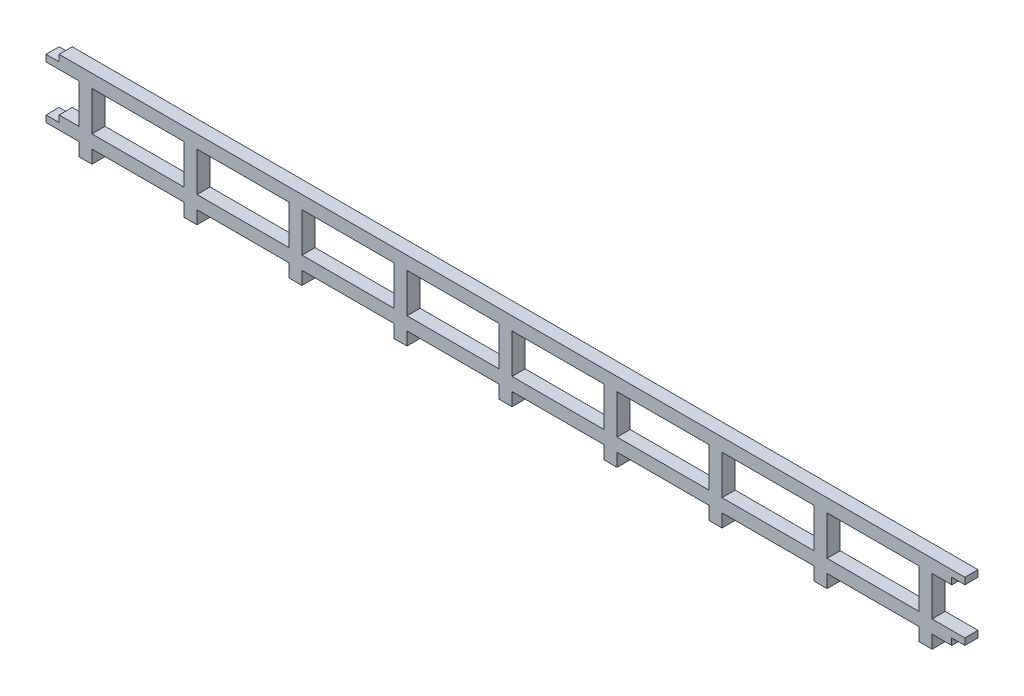
from build123d import *

# Parameters (mm, degrees)
SKETCH1_W           = 21
SKETCH1_H           = 9
BOSS_EXTRUDE1_DEPTH = 3


with BuildPart() as part:
    # Sketch1 → Boss-Extrude1 (new body)
    with BuildSketch(Plane.XY):
        Polygon((178.5, 24), (181.5, 24), (181.5, 27), (202.5, 27), (202.5, 24), (205.5, 24), (205.5, 27), (210, 27), (210, 28.5), (213, 28.5), (213, 30), (205.5, 30), (205.5, 39), (210, 39), (210, 40.5), (213, 40.5), (213, 42), (6, 42), (6, 40.5), (3, 40.5), (3, 39), (10.5, 39), (10.5, 30), (6, 30), (6, 28.5), (3, 28.5), (3, 27), (10.5, 27), (10.5, 24), (13.5, 24), (13.5, 27), (34.5, 27), (34.5, 24), (37.5, 24), (37.5, 27), (58.5, 27), (58.5, 24), (61.5, 24), (61.5, 27), (82.5, 27), (82.5, 24), (85.5, 24), (85.5, 27), (106.5, 27), (106.5, 24), (109.5, 24), (109.5, 27), (130.5, 27), (130.5, 24), (133.5, 24), (133.5, 27), (154.5, 27), (154.5, 24), (157.5, 24), (157.5, 27), (178.5, 27), align=None)
        with Locations((192, 34.5)):
            Rectangle(SKETCH1_W, SKETCH1_H, mode=Mode.SUBTRACT)
        with Locations((168, 34.5)):
            Rectangle(SKETCH1_W, SKETCH1_H, mode=Mode.SUBTRACT)
        with Locations((144, 34.5)):
            Rectangle(SKETCH1_W, SKETCH1_H, mode=Mode.SUBTRACT)
        with Locations((120, 34.5)):
            Rectangle(SKETCH1_W, SKETCH1_H, mode=Mode.SUBTRACT)
        with Locations((96, 34.5)):
            Rectangle(SKETCH1_W, SKETCH1_H, mode=Mode.SUBTRACT)
        with Locations((72, 34.5)):
            Rectangle(SKETCH1_W, SKETCH1_H, mode=Mode.SUBTRACT)
        with Locations((48, 34.5)):
            Rectangle(SKETCH1_W, SKETCH1_H, mode=Mode.SUBTRACT)
        with Locations((24, 34.5)):
            Rectangle(SKETCH1_W, SKETCH1_H, mode=Mode.SUBTRACT)
    extrude(amount=BOSS_EXTRUDE1_DEPTH)


solid = part.part
